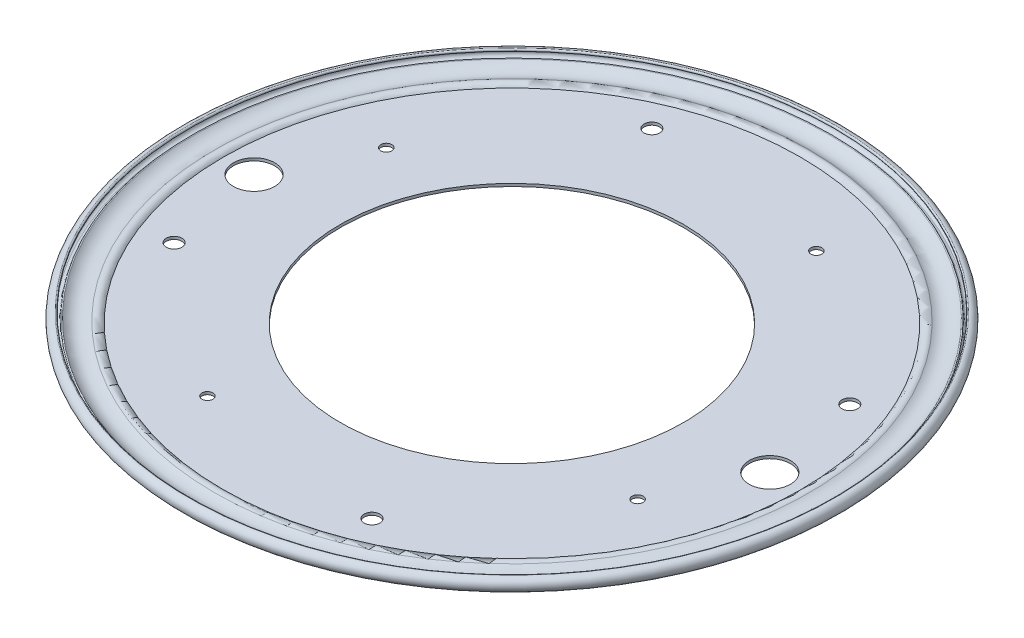
from build123d import *

# Parameters (mm, degrees)
CUT_EXTRUDE1_REACH = 217.58
SKETCH3_R          = 3.6195
SKETCH3_R_2        = 9.525
SKETCH3_R_3        = 2.54


with BuildPart() as part:
    # Sketch2 → Revolve1 (revolve)
    with BuildSketch(Plane(origin=(0, 0, 0), x_dir=(0, 0, -1), z_dir=(1, 0, 0)), mode=Mode.PRIVATE) as revolve1_sk:
        with BuildLine():
            add(Edge.make_bspline(
                [(-134.397000652, 0.551188735), (-133.999045602, 0.055074794), (-133.35, 0)],
                knots=[0, 0, 0, 1, 1, 1], degree=2))
            Line((-133.35, 0), (-79.375, 0))
            Line((-79.375, 0), (-79.375, 1.27))
            Line((-79.375, 1.27), (-133.35, 1.27))
            Line((-133.35, 1.27), (-135.481948533, 1.27))
            ThreePointArc((-135.481948533, 1.27), (-134.869603382, 1.016055461), (-134.397000652, 0.551188735))
        make_face()
        with BuildLine():
            ThreePointArc((-143.679605897, 0), (-141.47200539, -0.27), (-139.264404882, 0))
            Line((-139.264404882, 0), (-143.679605897, 0))
        make_face()
        with BuildLine():
            Line((-143.679605897, 0), (-139.264404882, 0))
            ThreePointArc((-139.264404882, 0), (-137.956661882, 0.431397277), (-136.728366852, 1.053961879))
            ThreePointArc((-136.728366852, 1.053961879), (-136.461400936, 1.185745278), (-136.175850928, 1.27))
            Line((-136.175850928, 1.27), (-139.425618329, 1.27))
            ThreePointArc((-139.425618329, 1.27), (-141.47200539, 1), (-143.51839245, 1.27))
            Line((-143.51839245, 1.27), (-146.555429433, 1.27))
            ThreePointArc((-146.555429433, 1.27), (-145.172408712, 0.510703177), (-143.679605897, 0))
        make_face()
        with BuildLine():
            ThreePointArc((-136.175850928, 1.27), (-135.82889973, 1.305005497), (-135.481948533, 1.27))
            Line((-135.481948533, 1.27), (-133.35, 1.27))
            ThreePointArc((-133.35, 1.27), (-135.195021074, 2.507432361), (-137.386054728, 2.140399479))
            ThreePointArc((-137.386054728, 2.140399479), (-138.375105279, 1.633188737), (-139.425618329, 1.27))
            Line((-139.425618329, 1.27), (-136.175850928, 1.27))
        make_face()
        with BuildLine():
            ThreePointArc((-149.352, 6.096), (-152.4, 3.048), (-149.352, 0))
            ThreePointArc((-149.352, 0), (-149.098576329, 0.010553631), (-148.846907606, 0.042141441))
            add(Edge.make_bspline(
                [(-148.846907606, 0.042141441), (-148.547749248, 0.145539292), (-147.917809082, 0.376379007), (-147.627032504, 0.992268812), (-147.526400479, 1.21814053), (-147.499323294, 1.27)],
                knots=[0, 0, 0, 0, 0.485698412, 0.694956748, 0.762028484, 0.762028484, 0.762028484, 0.762028484], degree=3))
            Line((-147.499323294, 1.27), (-149.352, 1.27))
            ThreePointArc((-149.352, 1.27), (-151.13, 3.047998982), (-149.352002036, 4.826))
            ThreePointArc((-149.352002036, 4.826), (-148.717002344, 5.460998982), (-149.352, 6.096))
        make_face()
        with BuildLine():
            ThreePointArc((-146.97989724, 1.570933983), (-146.769800535, 1.417452469), (-146.555429433, 1.27))
            Line((-146.555429433, 1.27), (-143.51839245, 1.27))
            ThreePointArc((-143.51839245, 1.27), (-145.365982171, 2.027854211), (-146.964119908, 3.225304234))
            add(Edge.make_bspline(
                [(-149.352, 1.27), (-148.807490473, 1.273686835), (-148.012516348, 1.648110571), (-147.619600478, 2.565535279), (-147.654453496, 3.18359), (-147.253276421, 3.505651273), (-146.964119908, 3.225304234)],
                knots=[0, 0, 0, 0, 0.465883887, 0.688178492, 0.820435413, 1, 1, 1, 1], degree=3))
            Line((-149.352, 1.27), (-147.499323294, 1.27))
            add(Edge.make_bspline(
                [(-147.499323294, 1.27), (-147.403253038, 1.453998172), (-147.273805216, 1.600673609), (-146.97989724, 1.570933983)],
                knots=[0.762028484, 0.762028484, 0.762028484, 0.762028484, 1, 1, 1, 1], degree=3))
        make_face()
    revolve(revolve1_sk.sketch.rotate(Axis((0, 0, 0), (0, 1, 0)), 180), axis=Axis((0, 0, 0), (0, 1, 0)))

    # Sketch3 → Cut-Extrude1 (cut, up to next)
    with BuildSketch(Plane(origin=(0, 1.27, 0), x_dir=(1, 0, 0), z_dir=(0, 1, 0)), mode=Mode.PRIVATE) as cut_extrude1_sk1:
        with Locations(Location((110.469899984, 45.754843108, 0), (0, 0, 270))):
            Circle(SKETCH3_R)
    cut_extrude1_tool1 = extrude(cut_extrude1_sk1.sketch, amount=-CUT_EXTRUDE1_REACH, mode=Mode.PRIVATE) & part.part
    # Sketch3 → Cut-Extrude1 (cut, up to next)
    with BuildSketch(Plane(origin=(0, 1.27, 0), x_dir=(1, 0, 0), z_dir=(0, 1, 0)), mode=Mode.PRIVATE) as cut_extrude1_sk2:
        with Locations(Location((119.253, 0, 0), (0, 0, 270))):
            Circle(SKETCH3_R_2)
    cut_extrude1_tool2 = extrude(cut_extrude1_sk2.sketch, amount=-CUT_EXTRUDE1_REACH, mode=Mode.PRIVATE) & part.part
    # Sketch3 → Cut-Extrude1 (cut, up to next)
    with BuildSketch(Plane(origin=(0, 1.27, 0), x_dir=(1, 0, 0), z_dir=(0, 1, 0)), mode=Mode.PRIVATE) as cut_extrude1_sk3:
        with Locations(Location((99.444492545, -41.342729936, 0), (0, 0, 270))):
            Circle(SKETCH3_R_3)
    cut_extrude1_tool3 = extrude(cut_extrude1_sk3.sketch, amount=-CUT_EXTRUDE1_REACH, mode=Mode.PRIVATE) & part.part
    # Sketch3 → Cut-Extrude1 (cut, up to next)
    with BuildSketch(Plane(origin=(0, 1.27, 0), x_dir=(1, 0, 0), z_dir=(0, 1, 0)), mode=Mode.PRIVATE) as cut_extrude1_sk4:
        with Locations(Location((45.754843108, -110.469899984, 0), (0, 0, 270))):
            Circle(SKETCH3_R)
    cut_extrude1_tool4 = extrude(cut_extrude1_sk4.sketch, amount=-CUT_EXTRUDE1_REACH, mode=Mode.PRIVATE) & part.part
    # Sketch3 → Cut-Extrude1 (cut, up to next)
    with BuildSketch(Plane(origin=(0, 1.27, 0), x_dir=(1, 0, 0), z_dir=(0, 1, 0)), mode=Mode.PRIVATE) as cut_extrude1_sk5:
        with Locations(Location((-41.342729935, -99.444492544, 0), (0, 0, 270))):
            Circle(SKETCH3_R_3)
    cut_extrude1_tool5 = extrude(cut_extrude1_sk5.sketch, amount=-CUT_EXTRUDE1_REACH, mode=Mode.PRIVATE) & part.part
    # Sketch3 → Cut-Extrude1 (cut, up to next)
    with BuildSketch(Plane(origin=(0, 1.27, 0), x_dir=(1, 0, 0), z_dir=(0, 1, 0)), mode=Mode.PRIVATE) as cut_extrude1_sk6:
        with Locations(Location((-110.469899984, -45.754843108, 0), (0, 0, 270))):
            Circle(SKETCH3_R)
    cut_extrude1_tool6 = extrude(cut_extrude1_sk6.sketch, amount=-CUT_EXTRUDE1_REACH, mode=Mode.PRIVATE) & part.part
    # Sketch3 → Cut-Extrude1 (cut, up to next)
    with BuildSketch(Plane(origin=(0, 1.27, 0), x_dir=(1, 0, 0), z_dir=(0, 1, 0)), mode=Mode.PRIVATE) as cut_extrude1_sk7:
        with Locations(Location((-119.253, 0, 0), (0, 0, 270))):
            Circle(SKETCH3_R_2)
    cut_extrude1_tool7 = extrude(cut_extrude1_sk7.sketch, amount=-CUT_EXTRUDE1_REACH, mode=Mode.PRIVATE) & part.part
    # Sketch3 → Cut-Extrude1 (cut, up to next)
    with BuildSketch(Plane(origin=(0, 1.27, 0), x_dir=(1, 0, 0), z_dir=(0, 1, 0)), mode=Mode.PRIVATE) as cut_extrude1_sk8:
        with Locations(Location((-99.444492544, 41.342729935, 0), (0, 0, 270))):
            Circle(SKETCH3_R_3)
    cut_extrude1_tool8 = extrude(cut_extrude1_sk8.sketch, amount=-CUT_EXTRUDE1_REACH, mode=Mode.PRIVATE) & part.part
    # Sketch3 → Cut-Extrude1 (cut, up to next)
    with BuildSketch(Plane(origin=(0, 1.27, 0), x_dir=(1, 0, 0), z_dir=(0, 1, 0)), mode=Mode.PRIVATE) as cut_extrude1_sk9:
        with Locations(Location((41.342729935, 99.444492545, 0), (0, 0, 270))):
            Circle(SKETCH3_R_3)
    cut_extrude1_tool9 = extrude(cut_extrude1_sk9.sketch, amount=-CUT_EXTRUDE1_REACH, mode=Mode.PRIVATE) & part.part
    # Sketch3 → Cut-Extrude1 (cut, up to next)
    with BuildSketch(Plane(origin=(0, 1.27, 0), x_dir=(1, 0, 0), z_dir=(0, 1, 0)), mode=Mode.PRIVATE) as cut_extrude1_sk10:
        with Locations(Location((-45.754843108, 110.469899984, 0), (0, 0, 270))):
            Circle(SKETCH3_R)
    cut_extrude1_tool10 = extrude(cut_extrude1_sk10.sketch, amount=-CUT_EXTRUDE1_REACH, mode=Mode.PRIVATE) & part.part
    add(cut_extrude1_tool1.solids().sort_by_distance((110.4699, 1.27, -45.754843))[0], mode=Mode.SUBTRACT)
    add(cut_extrude1_tool2.solids().sort_by_distance((119.253, 1.27, 0))[0], mode=Mode.SUBTRACT)
    add(cut_extrude1_tool3.solids().sort_by_distance((99.444493, 1.27, 41.34273))[0], mode=Mode.SUBTRACT)
    add(cut_extrude1_tool4.solids().sort_by_distance((45.754843, 1.27, 110.4699))[0], mode=Mode.SUBTRACT)
    add(cut_extrude1_tool5.solids().sort_by_distance((-41.34273, 1.27, 99.444493))[0], mode=Mode.SUBTRACT)
    add(cut_extrude1_tool6.solids().sort_by_distance((-110.4699, 1.27, 45.754843))[0], mode=Mode.SUBTRACT)
    add(cut_extrude1_tool7.solids().sort_by_distance((-119.253, 1.27, 0))[0], mode=Mode.SUBTRACT)
    add(cut_extrude1_tool8.solids().sort_by_distance((-99.444493, 1.27, -41.34273))[0], mode=Mode.SUBTRACT)
    add(cut_extrude1_tool9.solids().sort_by_distance((41.34273, 1.27, -99.444493))[0], mode=Mode.SUBTRACT)
    add(cut_extrude1_tool10.solids().sort_by_distance((-45.754843, 1.27, -110.4699))[0], mode=Mode.SUBTRACT)


solid = part.part
